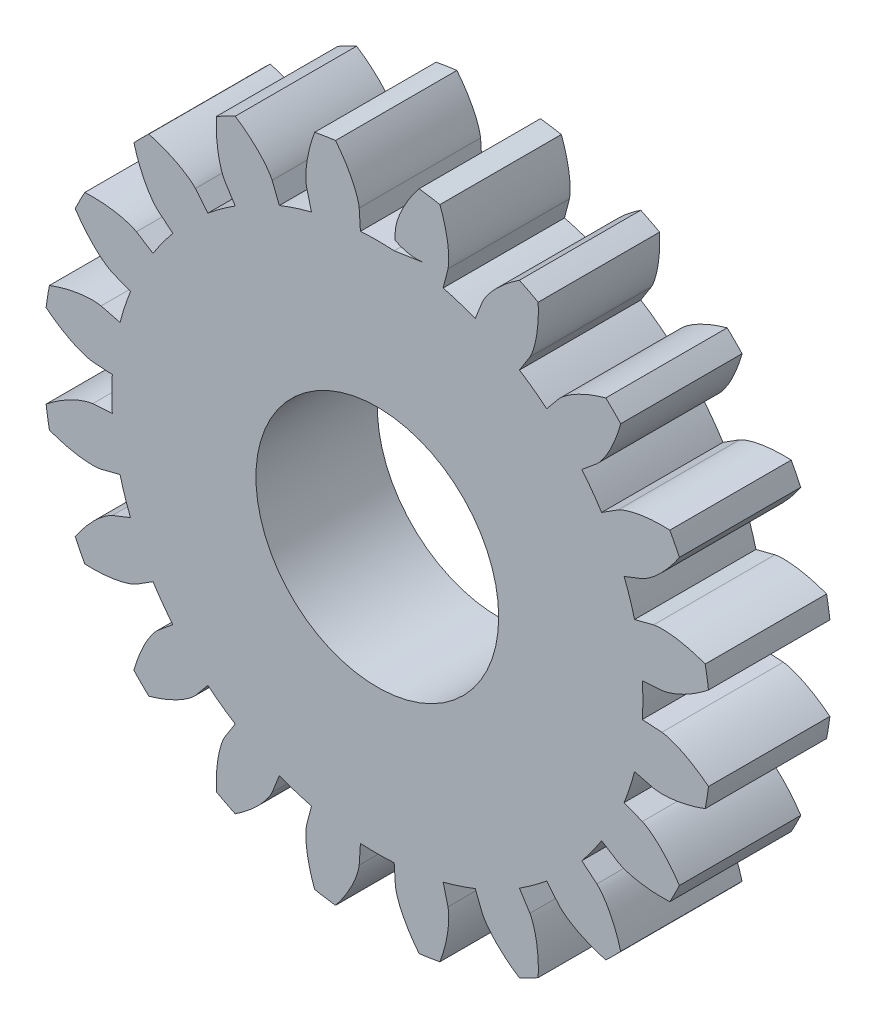
from build123d import *

# Parameters (mm, degrees)
SKETCH1_R           = 27.5
BOSS_EXTRUDE1_DEPTH = 5
CUT_EXTRUDE1_DEPTH  = 41.155946011
CUT_EXTRUDE2_DEPTH  = 41.155946172
CIRPATTERN1_COUNT   = 20
SKETCH5_R           = 10
CUT_EXTRUDE3_DEPTH  = 40.860026837
CUT_EXTRUDE4_DEPTH  = 40.860026837


with BuildPart() as part:
    # Sketch1 → Boss-Extrude1 (new, symmetric)
    with BuildSketch(Plane.XY):
        Circle(SKETCH1_R)
    extrude(amount=BOSS_EXTRUDE1_DEPTH, both=True)

    # Sketch2 → Cut-Extrude1 (cut, through all)
    with BuildSketch(Plane.XY.offset(5)):
        with BuildLine():
            ThreePointArc((-1.492192858, 23.442556611), (0, 23.49), (1.492192858, 23.442556611))
            add(Edge.make_bspline(
                [(1.492192858, 23.442556611), (1.509703149, 23.613515204), (1.598056956, 23.990887646), (1.822980926, 24.640546676), (2.205804226, 25.458419905), (3.090420272, 26.93307024), (4.021139918, 28.014218864), (4.755897678, 28.734820989)],
                knots=[0, 0, 0, 0, 0.081635884, 0.183676701, 0.326533469, 0.510206256, 1, 1, 1, 1], degree=3))
            ThreePointArc((4.755897678, 28.734820989), (0, 29.149189424), (-4.755897678, 28.734820989))
            add(Edge.make_bspline(
                [(-1.492192858, 23.442556611), (-1.509703149, 23.613515204), (-1.598056956, 23.990887646), (-1.822980926, 24.640546676), (-2.205804226, 25.458419905), (-3.090420272, 26.93307024), (-4.021139918, 28.014218864), (-4.755897678, 28.734820989)],
                knots=[0, 0, 0, 0, 0.081635884, 0.183676701, 0.326533469, 0.510206256, 1, 1, 1, 1], degree=3))
        make_face()
    cut_extrude1 = extrude(amount=-CUT_EXTRUDE1_DEPTH, mode=Mode.SUBTRACT)

    # Sketch4 → Cut-Extrude2 (cut, through all)
    with BuildSketch(Plane.XY.offset(5)):
        with BuildLine():
            Line((-1.492192858, 23.442556611), (-1.389600629, 21.830818471))
            ThreePointArc((-1.389600629, 21.830818471), (0, 21.875), (1.389600629, 21.830818471))
            Line((1.389600629, 21.830818471), (1.492192858, 23.442556611))
            ThreePointArc((1.492192858, 23.442556611), (0, 23.49), (-1.492192858, 23.442556611))
        make_face()
    cut_extrude2 = extrude(amount=-CUT_EXTRUDE2_DEPTH, mode=Mode.SUBTRACT)

    # CirPattern1: Cut-Extrude1, Cut-Extrude2 ×20 about axis
    cirpattern1_axis = Axis((0, 0, 5), (0, 0, -1))
    add([cut_extrude1.rotate(cirpattern1_axis, i * 360 / CIRPATTERN1_COUNT) for i in range(1, CIRPATTERN1_COUNT)], mode=Mode.SUBTRACT)
    add([cut_extrude2.rotate(cirpattern1_axis, i * 360 / CIRPATTERN1_COUNT) for i in range(1, CIRPATTERN1_COUNT)], mode=Mode.SUBTRACT)

    # Sketch5 → Cut-Extrude3 (cut, through all)
    with BuildSketch(Plane.XY.offset(5)):
        Circle(SKETCH5_R)
    extrude(amount=-CUT_EXTRUDE3_DEPTH, mode=Mode.SUBTRACT)

    # Sketch6 → Cut-Extrude4 (cut, through all)
    with BuildSketch(Plane.XY.offset(5)):
        with BuildLine():
            Line((1.440896743, 22.636687541), (1.389600629, 21.830818471))
            add(Edge.make_bspline(
                [(1.389600629, 21.830818471), (2.554161632, 22.005766218), (3.717170851, 22.190823348)],
                knots=[0, 0, 0, 1, 1, 1], degree=2))
            add(Edge.make_bspline(
                [(3.717170851, 22.190823348), (2.541558077, 22.061569553), (1.440896743, 22.636687541)],
                knots=[0, 0, 0, 1, 1, 1], degree=2))
        make_face()
    extrude(amount=-CUT_EXTRUDE4_DEPTH, mode=Mode.SUBTRACT)


solid = part.part
